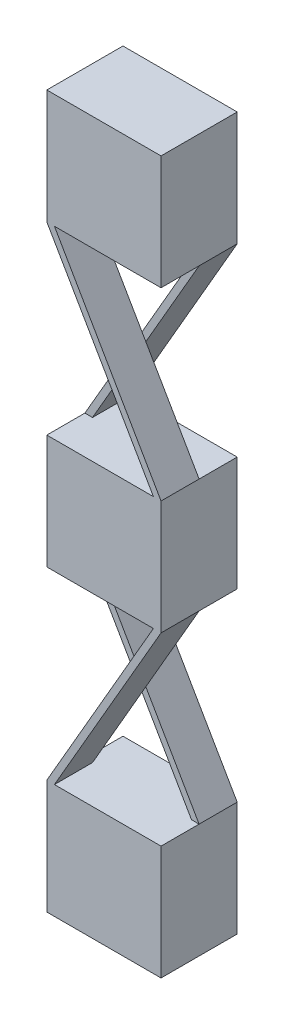
from build123d import *

# Parameters (mm, degrees)
SKETCH1_W           = 15
SKETCH1_H           = 15
BOSS_EXTRUDE1_DEPTH = 5
BOSS_EXTRUDE2_START = 5
BOSS_EXTRUDE2_DEPTH = 5
BOSS_EXTRUDE3_START = -5
BOSS_EXTRUDE3_DEPTH = 5
SKETCH1_5_W         = 15
SKETCH1_5_H         = 15
BOSS_EXTRUDE4_DEPTH = 5


with BuildPart() as part:
    # Sketch1 → Boss-Extrude1 (new, symmetric)
    with BuildSketch(Plane.XY):
        with Locations((0, -19.624355653)):
            Rectangle(SKETCH1_W, SKETCH1_H)
    boss_extrude1 = extrude(amount=BOSS_EXTRUDE1_DEPTH, both=True)

    # Sketch1<3> → Boss-Extrude2 (add)
    with BuildSketch(Plane.XY.offset(BOSS_EXTRUDE2_START)):
        Polygon((-6.5, -12.124355653), (0, -0.866025404), (-0.5, 0), (-7.5, -12.124355653), align=None)
        Polygon((0.5, 0), (7.5, 12.124355653), (6.5, 12.124355653), (0, 0.866025404), align=None)
        Polygon((0, -0.866025404), (0.5, 0), (0, 0.866025404), (-0.5, 0), align=None)
    boss_extrude2 = extrude(amount=-BOSS_EXTRUDE2_DEPTH)

    # Sketch1<4> → Boss-Extrude3 (add)
    with BuildSketch(Plane.XY.offset(BOSS_EXTRUDE3_START)):
        Polygon((0, 0.866025404), (-6.5, 12.124355653), (-7.5, 12.124355653), (-0.5, 0), align=None)
        Polygon((7.5, -12.124355653), (0.5, 0), (0, -0.866025404), (6.5, -12.124355653), align=None)
        Polygon((0, -0.866025404), (0.5, 0), (0, 0.866025404), (-0.5, 0), align=None)
    boss_extrude3 = extrude(amount=BOSS_EXTRUDE3_DEPTH)

    # Sketch1<5> → Boss-Extrude4 (add, symmetric)
    with BuildSketch(Plane.XY):
        with Locations((0, 19.624355653)):
            Rectangle(SKETCH1_5_W, SKETCH1_5_H)
    extrude(amount=BOSS_EXTRUDE4_DEPTH, both=True)

    # Mirror2: Boss-Extrude2, Boss-Extrude3 across plane
    add(boss_extrude2.mirror(Plane(origin=(0, 19.624355653, 0), x_dir=(0, 0, 1), z_dir=(0, -1, 0))))
    add(boss_extrude3.mirror(Plane(origin=(0, 19.624355653, 0), x_dir=(0, 0, 1), z_dir=(0, -1, 0))))

    # Mirror3: Boss-Extrude1 across plane
    add(boss_extrude1.mirror(Plane(origin=(0, 19.624355653, 0), x_dir=(0, 0, 1), z_dir=(0, -1, 0))))


solid = part.part
